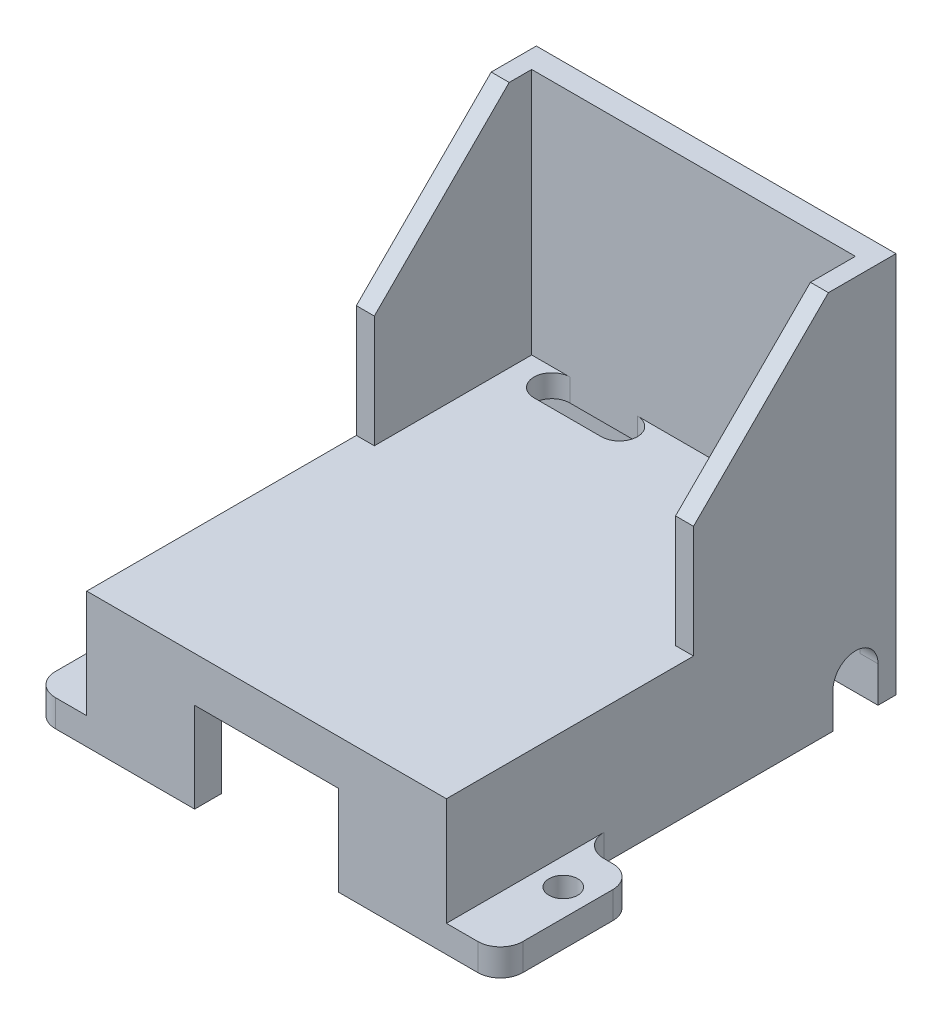
from build123d import *

# Parameters (mm, degrees)
SKETCH1_W               = 40
SKETCH1_H               = 50
BOSS_EXTRUDE1_DEPTH     = 15
SKETCH2_W               = 16
SKETCH2_H               = 3
CUT_EXTRUDE1_DEPTH      = 10
SKETCH3_W               = 36
SKETCH3_H               = 45
CUT_EXTRUDE2_DEPTH      = 12.5
SKETCH4_W               = 40
SKETCH4_H               = 2.515653855
BOSS_EXTRUDE2_DEPTH     = 27.5
CUT_EXTRUDE3_DEPTH      = 70.686799324
SKETCH6_W               = 2
SKETCH6_H               = 17.5
SKETCH6_H_2             = 20
BOSS_EXTRUDE3_DEPTH     = 27.5
CUT_EXTRUDE5_DEPTH      = 77.852130745
CUT_EXTRUDE5_DEPTH_BACK = 77.852130745
SKETCH8_W               = 15
SKETCH8_H               = 3
BOSS_EXTRUDE4_DEPTH     = 6
SKETCH9_R               = 1.6
CUT_EXTRUDE6_DEPTH      = 79.589121385
FILLET1_R               = 2.5
CHAMFER3_SIZE           = 15


with BuildPart() as part:
    # Sketch1 → Boss-Extrude1 (new body)
    with BuildSketch(Plane(origin=(0, 0, 0), x_dir=(1, 0, 0), z_dir=(0, 1, 0))):
        with Locations((20, 25)):
            Rectangle(SKETCH1_W, SKETCH1_H)
    extrude(amount=BOSS_EXTRUDE1_DEPTH)

    # Sketch2 → Cut-Extrude1 (cut)
    with BuildSketch(Plane.XZ):
        with Locations((20, -1.5)):
            Rectangle(SKETCH2_W, SKETCH2_H)
    extrude(amount=-CUT_EXTRUDE1_DEPTH, mode=Mode.SUBTRACT)

    # Sketch3 → Cut-Extrude2 (cut)
    with BuildSketch(Plane.XZ):
        with Locations((20, -25.5)):
            Rectangle(SKETCH3_W, SKETCH3_H)
    extrude(amount=-CUT_EXTRUDE2_DEPTH, mode=Mode.SUBTRACT)

    # Sketch4 → Boss-Extrude2 (add)
    with BuildSketch(Plane(origin=(0, 15, 0), x_dir=(1, 0, 0), z_dir=(0, 1, 0))):
        with Locations((20, 48.742173073)):
            Rectangle(SKETCH4_W, SKETCH4_H)
    extrude(amount=BOSS_EXTRUDE2_DEPTH)

    # Sketch5 → Cut-Extrude3 (cut, through all)
    with BuildSketch(Plane(origin=(0, 15, 0), x_dir=(1, 0, 0), z_dir=(0, 1, 0))):
        with BuildLine():
            Line((13.75, 47.484346145), (6.25, 47.484346145))
            ThreePointArc((6.25, 47.484346145), (4.25, 45.484346145), (6.25, 43.484346145))
            Line((6.25, 43.484346145), (13.75, 43.484346145))
            ThreePointArc((13.75, 43.484346145), (15.75, 45.484346145), (13.75, 47.484346145))
        make_face()
        with BuildLine():
            Line((33.25, 47.484346145), (25.75, 47.484346145))
            ThreePointArc((25.75, 47.484346145), (23.75, 45.484346145), (25.75, 43.484346145))
            Line((25.75, 43.484346145), (33.25, 43.484346145))
            ThreePointArc((33.25, 43.484346145), (35.25, 45.484346145), (33.25, 47.484346145))
        make_face()
    extrude(amount=-CUT_EXTRUDE3_DEPTH, mode=Mode.SUBTRACT)

    # Sketch6 → Boss-Extrude3 (add)
    with BuildSketch(Plane(origin=(0, 15, 0), x_dir=(1, 0, 0), z_dir=(0, 1, 0))):
        with Locations((1, 38.734346145)):
            Rectangle(SKETCH6_W, SKETCH6_H)
        with Locations((39, 37.484346145)):
            Rectangle(SKETCH6_W, SKETCH6_H_2)
    extrude(amount=BOSS_EXTRUDE3_DEPTH)

    # Sketch7 → Cut-Extrude5 (cut, two sides: drawn at the far end of the back side and taken through both)
    with BuildSketch(Plane.ZY.offset(-CUT_EXTRUDE5_DEPTH_BACK)):
        with BuildLine():
            Line((-48, 4), (-48, 0))
            Line((-48, 0), (-43, 0))
            Line((-43, 0), (-43, 4))
            ThreePointArc((-43, 4), (-45.5, 6.5), (-48, 4))
        make_face()
    extrude(amount=CUT_EXTRUDE5_DEPTH + CUT_EXTRUDE5_DEPTH_BACK, mode=Mode.SUBTRACT)

    # Sketch8 → Boss-Extrude4 (add)
    with BuildSketch(Plane(origin=(40, 0, 0), x_dir=(0, 0, -1), z_dir=(1, 0, 0))):
        with Locations((7.5, 1.5)):
            Rectangle(SKETCH8_W, SKETCH8_H)
    boss_extrude4 = extrude(amount=BOSS_EXTRUDE4_DEPTH)

    # Sketch9 → Cut-Extrude6 (cut, through all)
    with BuildSketch(Plane(origin=(0, 3, 0), x_dir=(1, 0, 0), z_dir=(0, 1, 0))):
        with Locations(Location((43, 10, 0), (0, 0, 270))):
            Circle(SKETCH9_R)
    cut_extrude6 = extrude(amount=-CUT_EXTRUDE6_DEPTH, mode=Mode.SUBTRACT)

    # Mirror1: Boss-Extrude4, Cut-Extrude6 across plane
    add(boss_extrude4.mirror(Plane.ZY.offset(-20)))
    add(cut_extrude6.mirror(Plane.ZY.offset(-20)), mode=Mode.SUBTRACT)

    # Fillet1
    fillet1_edges = [part.edges().sort_by_distance(p)[0] for p in [
        (40, 1.5, -15),
        (46, 1.5, 0),
        (46, 1.5, -15),
        (-6, 1.5, 0),
        (-6, 1.5, -15),
        (0, 1.5, -15),
    ]]
    fillet(fillet1_edges, radius=FILLET1_R)

    # Chamfer3
    chamfer3_edges = [part.edges().sort_by_distance(p)[0] for p in [
        (39, 42.5, -27.484346145),
        (1, 42.5, -29.984346145),
    ]]
    chamfer(chamfer3_edges, length=CHAMFER3_SIZE)


solid = part.part
